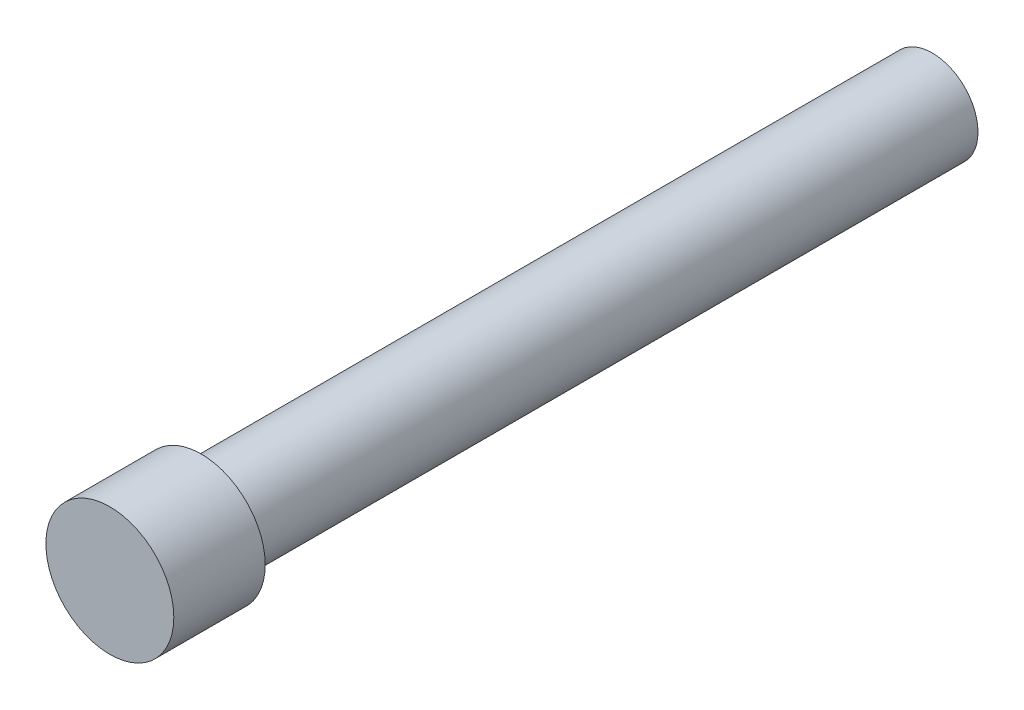
from build123d import *

# Parameters (mm, degrees)
SKETCH1_R           = 5
BOSS_EXTRUDE1_DEPTH = 80
SKETCH2_R           = 7
BOSS_EXTRUDE2_DEPTH = 10


with BuildPart() as part:
    # Sketch1 → Boss-Extrude1 (new body)
    with BuildSketch(Plane.XY):
        Circle(SKETCH1_R)
    extrude(amount=BOSS_EXTRUDE1_DEPTH)

    # Sketch2 → Boss-Extrude2 (add)
    with BuildSketch(Plane.XY.offset(80)):
        Circle(SKETCH2_R)
    extrude(amount=BOSS_EXTRUDE2_DEPTH)


solid = part.part
